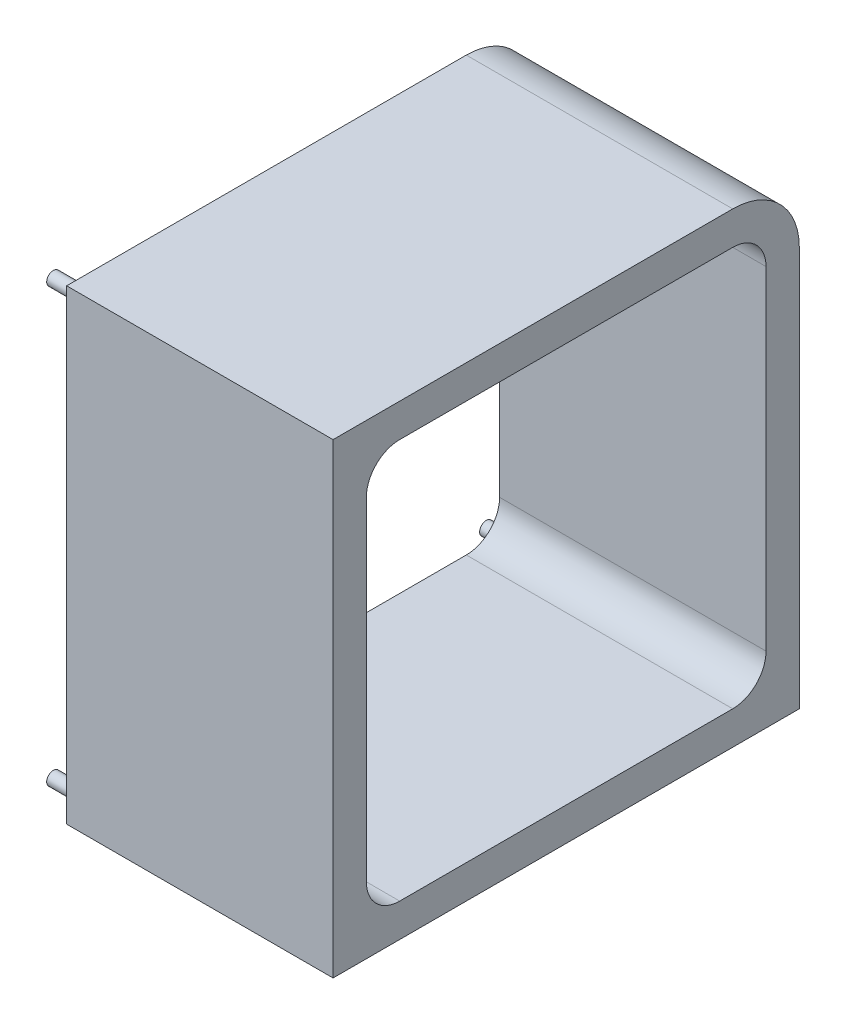
from build123d import *

# Parameters (mm, degrees)
EXTRUDE_1_DEPTH = 80
SKETCH_2_R      = 2
EXTRUDE_2_DEPTH = 9


with BuildPart() as part:
    # 草图1 → 凸台-拉伸1 (new body)
    with BuildSketch(Plane(origin=(0, 0, 0), x_dir=(0, 0, -1), z_dir=(1, 0, 0))):
        with BuildLine():
            Line((0, 0), (140, 0))
            Line((140, 0), (140, 120))
            ThreePointArc((140, 120), (134.142135624, 134.142135624), (120, 140))
            Line((120, 140), (0, 140))
            Line((0, 140), (0, 0))
        make_face()
        with BuildLine():
            Line((20, 130), (120, 130))
            ThreePointArc((120, 130), (127.071067812, 127.071067812), (130, 120))
            Line((130, 120), (130, 20))
            ThreePointArc((130, 20), (127.071067812, 12.928932188), (120, 10))
            Line((120, 10), (20, 10))
            ThreePointArc((20, 10), (12.928932188, 12.928932188), (10, 20))
            Line((10, 20), (10, 120))
            ThreePointArc((10, 120), (12.928932188, 127.071067812), (20, 130))
        make_face(mode=Mode.SUBTRACT)
    extrude(amount=EXTRUDE_1_DEPTH)

    # 草图2 → 凸台-拉伸2 (add)
    with BuildSketch(Plane.ZY):
        with Locations((-5, 135)):
            Circle(SKETCH_2_R)
        with Locations((-135, 5)):
            Circle(SKETCH_2_R)
        with Locations((-5, 5)):
            Circle(SKETCH_2_R)
    extrude(amount=EXTRUDE_2_DEPTH)


solid = part.part
